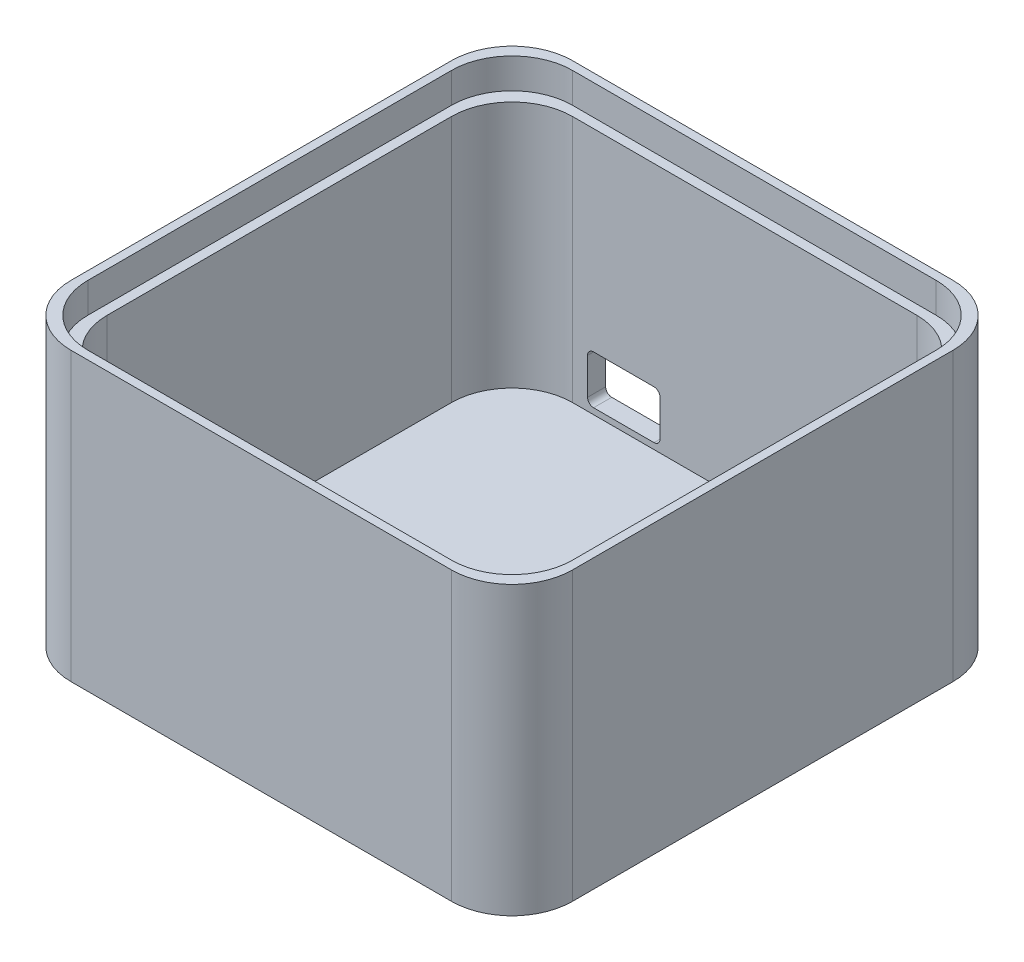
from build123d import *

# Parameters (mm, degrees)
BOSS_EXTRUDE1_DEPTH = 46
CUT_EXTRUDE1_DEPTH  = 5
BOSS_EXTRUDE2_START = 1.5
BOSS_EXTRUDE2_DEPTH = 1.5
SKETCH4_R           = 3
CUT_EXTRUDE2_DEPTH  = 8


with BuildPart() as part:
    # Sketch1 → Boss-Extrude1 (new body)
    with BuildSketch(Plane(origin=(0, 0, 0), x_dir=(1, 0, 0), z_dir=(0, 1, 0))):
        with BuildLine():
            Line((-31.5, 41.5), (31.5, 41.5))
            ThreePointArc((31.5, 41.5), (38.571067812, 38.571067812), (41.5, 31.5))
            Line((41.5, 31.5), (41.5, -31.5))
            ThreePointArc((41.5, -31.5), (38.571067812, -38.571067812), (31.5, -41.5))
            Line((31.5, -41.5), (-31.5, -41.5))
            ThreePointArc((-31.5, -41.5), (-38.571067812, -38.571067812), (-41.5, -31.5))
            Line((-41.5, -31.5), (-41.5, 31.5))
            ThreePointArc((-41.5, 31.5), (-38.571067812, 38.571067812), (-31.5, 41.5))
        make_face()
        with BuildLine():
            Line((-28.5, 38.5), (28.5, 38.5))
            ThreePointArc((28.5, 38.5), (35.571067812, 35.571067812), (38.5, 28.5))
            Line((38.5, 28.5), (38.5, -28.5))
            ThreePointArc((38.5, -28.5), (35.571067812, -35.571067812), (28.5, -38.5))
            Line((28.5, -38.5), (-28.5, -38.5))
            ThreePointArc((-28.5, -38.5), (-35.571067812, -35.571067812), (-38.5, -28.5))
            Line((-38.5, -28.5), (-38.5, 28.5))
            ThreePointArc((-38.5, 28.5), (-35.571067812, 35.571067812), (-28.5, 38.5))
        make_face(mode=Mode.SUBTRACT)
    extrude(amount=BOSS_EXTRUDE1_DEPTH)

    # Sketch2 → Cut-Extrude1 (cut)
    with BuildSketch(Plane(origin=(0, 46, 0), x_dir=(1, 0, 0), z_dir=(0, 1, 0))):
        with BuildLine():
            Line((-30.1, 40.1), (30.1, 40.1))
            ThreePointArc((30.1, 40.1), (37.171067812, 37.171067812), (40.1, 30.1))
            Line((40.1, 30.1), (40.1, -30.1))
            ThreePointArc((40.1, -30.1), (37.171067812, -37.171067812), (30.1, -40.1))
            Line((30.1, -40.1), (-30.1, -40.1))
            ThreePointArc((-30.1, -40.1), (-37.171067812, -37.171067812), (-40.1, -30.1))
            Line((-40.1, -30.1), (-40.1, 30.1))
            ThreePointArc((-40.1, 30.1), (-37.171067812, 37.171067812), (-30.1, 40.1))
        make_face()
    extrude(amount=-CUT_EXTRUDE1_DEPTH, mode=Mode.SUBTRACT)

    # Sketch3 → Boss-Extrude2 (add)
    with BuildSketch(Plane.XZ.offset(BOSS_EXTRUDE2_START)):
        with BuildLine():
            Line((-31.5, 41.5), (31.5, 41.5))
            ThreePointArc((31.5, 41.5), (38.571067812, 38.571067812), (41.5, 31.5))
            Line((41.5, 31.5), (41.5, -31.5))
            ThreePointArc((41.5, -31.5), (38.571067812, -38.571067812), (31.5, -41.5))
            Line((31.5, -41.5), (-31.5, -41.5))
            ThreePointArc((-31.5, -41.5), (-38.571067812, -38.571067812), (-41.5, -31.5))
            Line((-41.5, -31.5), (-41.5, 31.5))
            ThreePointArc((-41.5, 31.5), (-38.571067812, 38.571067812), (-31.5, 41.5))
        make_face()
    extrude(amount=-BOSS_EXTRUDE2_DEPTH)

    # Sketch4 → Cut-Extrude2 (cut)
    with BuildSketch(Plane(origin=(0, 0, -41.5), x_dir=(-1, 0, 0), z_dir=(0, 0, -1))):
        with Locations((-20, 5)):
            Circle(SKETCH4_R)
        with BuildLine():
            Line((15, 1), (25, 1))
            ThreePointArc((25, 1), (25.707106781, 1.292893219), (26, 2))
            Line((26, 2), (26, 8))
            ThreePointArc((26, 8), (25.707106781, 8.707106781), (25, 9))
            Line((25, 9), (15, 9))
            ThreePointArc((15, 9), (14.292893219, 8.707106781), (14, 8))
            Line((14, 8), (14, 2))
            ThreePointArc((14, 2), (14.292893219, 1.292893219), (15, 1))
        make_face()
    extrude(amount=-CUT_EXTRUDE2_DEPTH, mode=Mode.SUBTRACT)


solid = part.part
